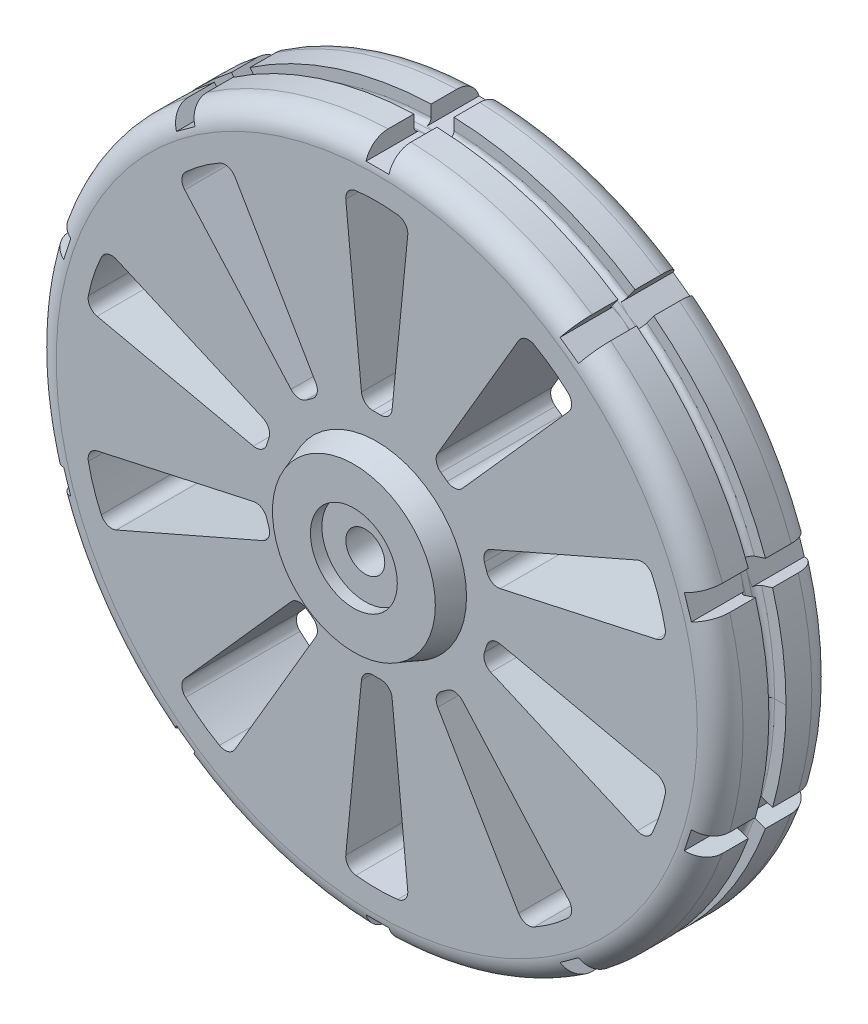
from build123d import *
from build123d.topology import SkipClean

# Parameters (mm, degrees)
SKETCH1_R           = 30
BOSS_EXTRUDE1_DEPTH = 10
SKETCH3_R           = 1
CUT_EXTRUDE1_DEPTH  = 44.58898943540674
CUT_EXTRUDE2_DEPTH  = 44.58898943540674
SKETCH12_R          = 5
BOSS_EXTRUDE3_DEPTH = 4
SKETCH5_R           = 7.8415500653594865
BOSS_EXTRUDE2_DEPTH = 2
BOSS_EXTRUDE2_TAPER = 20.000000000000043
SKETCH6_R           = 1.7
CUT_EXTRUDE3_DEPTH  = 45.090815370097204
CUT_EXTRUDE4_DEPTH  = 44.58898943540674
CIRPATTERN1_COUNT   = 10
FILLET1_R           = 1
FILLET2_R           = 2
FILLET3_R           = 0.5
SKETCH11_W          = 2
SKETCH11_H          = 3
CUT_EXTRUDE5_DEPTH  = 44.58898943540674
CIRPATTERN2_COUNT   = 10
SKETCH13_R          = 3.7935695120059236
CUT_EXTRUDE6_DEPTH  = 1


with BuildPart() as part:
    # Sketch1 → Boss-Extrude1 (new body)
    with BuildSketch(Plane.XY):
        Circle(SKETCH1_R)
    extrude(amount=-BOSS_EXTRUDE1_DEPTH)

    # Sketch3 → Cut-Extrude1 (cut, through all)
    with BuildSketch(Plane.XY):
        Circle(SKETCH3_R)
    extrude(amount=-CUT_EXTRUDE1_DEPTH, mode=Mode.SUBTRACT)

    # Sketch4 → Cut-Extrude2 (cut, through all)
    with BuildSketch(Plane.XY):
        with BuildLine():
            Line((-1.6802173473795907, 2.3636559956061087), (-2.6876638659904035, -1.0892487977727972))
            ThreePointArc((-2.6876638659904035, -1.0892487977727972), (-0.8122595326849547, -2.783924289840222), (1.6802173473796043, -2.3636559956060896))
            Line((1.6802173473796043, -2.3636559956060896), (2.6876638659904186, 1.0892487977727825))
            ThreePointArc((2.6876638659904186, 1.0892487977727825), (0.8122595326849772, 2.783924289840224), (-1.6802173473795907, 2.3636559956061087))
        make_face()
    extrude(amount=-CUT_EXTRUDE2_DEPTH, mode=Mode.SUBTRACT)

    # Sketch12 → Boss-Extrude3 (add)
    with BuildSketch(Plane.XY):
        Circle(SKETCH12_R)
    extrude(amount=-BOSS_EXTRUDE3_DEPTH)

    # Sketch5 → Boss-Extrude2 (add)
    with BuildSketch(Plane.XY):
        Circle(SKETCH5_R)
    extrude(amount=BOSS_EXTRUDE2_DEPTH, taper=BOSS_EXTRUDE2_TAPER)

    # Sketch6 → Cut-Extrude3 (cut, through all)
    with BuildSketch(Plane.XY.offset(2)):
        Circle(SKETCH6_R)
    extrude(amount=-CUT_EXTRUDE3_DEPTH, mode=Mode.SUBTRACT)

    # Sketch7 → Cut-Extrude4 (cut, through all)
    with BuildSketch(Plane.XY):
        with BuildLine():
            Line((-2.8, 25.75309493401217), (-1.25, 9.999999999999998))
            Line((-1.25, 9.999999999999998), (1.25, 9.999999999999998))
            Line((1.25, 9.999999999999998), (2.8, 25.75309493401217))
            ThreePointArc((2.8, 25.75309493401217), (1.405432505637538, 25.938154205305498), (0, 26))
            ThreePointArc((0, 26), (-1.4054325056375396, 25.938154205305498), (-2.8, 25.75309493401217))
        make_face()
    cut_extrude4 = extrude(amount=-CUT_EXTRUDE4_DEPTH, mode=Mode.SUBTRACT)

    # CirPattern1: Cut-Extrude4 ×10 about axis
    cirpattern1_axis = Axis((-2.6e-16, -4.3e-16, 0), (0, 0, 1))
    for i in range(1, CIRPATTERN1_COUNT):
        add(cut_extrude4.rotate(cirpattern1_axis, i * 360 / CIRPATTERN1_COUNT), mode=Mode.SUBTRACT)

    # Fillet1
    fillet1_edges = [part.edges().sort_by_distance(p)[0] for p in [
        (9.896836405920219, 1.9013492983805294, -5),
        (9.12429391998285, 4.278990589118413, -5),
        (23.627401167510136, 10.621102237987552, -5),
        (25.357896336009844, 5.295185746734691, -5),
        (6.889123765893417, 7.355438378383881, -5),
        (4.866581279956049, 8.824901509115065, -5),
        (12.872041818850512, 22.48049016578614, -5),
        (17.402536987350217, 19.188892752948288, -5),
        (4.866581279956045, -8.824901509115065, -5),
        (6.889123765893413, -7.355438378383883, -5),
        (17.40253698735021, -19.188892752948288, -5),
        (12.872041818850503, -22.48049016578614, -5),
        (9.124293919982849, -4.278990589118417, -5),
        (9.896836405920217, -1.9013492983805331, -5),
        (25.35789633600984, -5.295185746734699, -5),
        (23.627401167510133, -10.621102237987557, -5),
        (-9.124293919982849, 4.278990589118416, -5),
        (-9.896836405920217, 1.9013492983805322, -5),
        (-25.35789633600984, 5.295185746734698, -5),
        (-23.627401167510133, 10.621102237987557, -5),
        (-9.896836405920219, -1.9013492983805322, -5),
        (-9.12429391998285, -4.278990589118417, -5),
        (-23.627401167510136, -10.621102237987559, -5),
        (-25.357896336009844, -5.295185746734697, -5),
        (-6.889123765893417, -7.355438378383882, -5),
        (-4.866581279956049, -8.824901509115064, -5),
        (-12.872041818850509, -22.48049016578614, -5),
        (-17.402536987350214, -19.188892752948288, -5),
        (-1.2500000000000018, -9.999999999999998, -5),
        (1.2499999999999982, -9.999999999999998, -5),
        (2.7999999999999967, -25.753094934012175, -5),
        (-2.800000000000004, -25.753094934012175, -5),
        (-4.866581279956046, 8.824901509115064, -5),
        (-6.889123765893414, 7.355438378383881, -5),
        (-17.40253698735021, 19.188892752948288, -5),
        (-12.872041818850505, 22.48049016578614, -5),
        (1.25, 9.999999999999998, -5),
        (-1.25, 9.999999999999998, -5),
        (-2.8000000000000003, 25.753094934012175, -5),
        (2.8000000000000003, 25.753094934012175, -5),
    ]]
    fillet(fillet1_edges, radius=FILLET1_R)

    # Fillet2
    fillet2_edges = [part.edges().sort_by_distance(p)[0] for p in [
        (-30, 1.7e-14, 0),
        (-30, 1.7e-14, -10),
    ]]
    fillet(fillet2_edges, radius=FILLET2_R)

    # Cut-Sweep1: sweep along a curve in space
    with BuildLine() as cut_sweep1_path:
        ThreePointArc((27.999999999999996, 0, 0), (19.79898987322333, 19.798989873223327, 0), (0, 27.999999999999996, 0))
        ThreePointArc((0, 27.999999999999996, 0), (-19.798989873223327, 19.79898987322333, 0), (-27.999999999999996, 0, 0))
        ThreePointArc((-27.999999999999996, 0, 0), (-19.79898987322333, -19.798989873223327, 0), (0, -27.999999999999996, 0))
        ThreePointArc((0, -27.999999999999996, 0), (19.798989873223327, -19.79898987322333, 0), (27.999999999999996, 0, 0))
    # Sketch8 → Cut-Sweep1 (sweep, cut)
    with BuildSketch(Plane(origin=(0, 0, 0), x_dir=(0, 0, -1), z_dir=(1, 0, 0))):
        Polygon((4.25, 30), (4.25, 28.499999999999996), (5.750000000000001, 28.499999999999996), (5.75, 30), align=None)
    sweep(path=cut_sweep1_path.line, mode=Mode.SUBTRACT)

    # Fillet3
    fillet3_edges = [part.edges().sort_by_distance(p)[0] for p in [
        (-7.41e-15, 28.5, -5.750000000000001),
        (-7.41e-15, 28.5, -4.25),
        (-7.41e-15, 28.5, -5.750000000000001),
        (-7.41e-15, 28.5, -4.25),
    ]]
    fillet(fillet3_edges, radius=FILLET3_R)

    # Sketch11 → Cut-Extrude5 (cut, through all)
    with SkipClean():  # the faces are left unmerged after this step: merging them gives an invalid solid
        with BuildSketch(Plane.XY):
            with Locations((-4.4e-16, 30.000000000000004)):
                Rectangle(SKETCH11_W, SKETCH11_H)
        cut_extrude5 = extrude(amount=-CUT_EXTRUDE5_DEPTH, mode=Mode.SUBTRACT)

    # CirPattern2: Cut-Extrude5 ×10 about axis
    cirpattern2_axis = Axis((-1e-15, -6.9e-16, 0), (0, 0, 1))
    for i in range(1, CIRPATTERN2_COUNT):
        add(cut_extrude5.rotate(cirpattern2_axis, i * 360 / CIRPATTERN2_COUNT), mode=Mode.SUBTRACT)

    # Sketch13 → Cut-Extrude6 (cut)
    with BuildSketch(Plane.XY.offset(2)):
        Circle(SKETCH13_R)
    extrude(amount=-CUT_EXTRUDE6_DEPTH, mode=Mode.SUBTRACT)


solid = part.part
